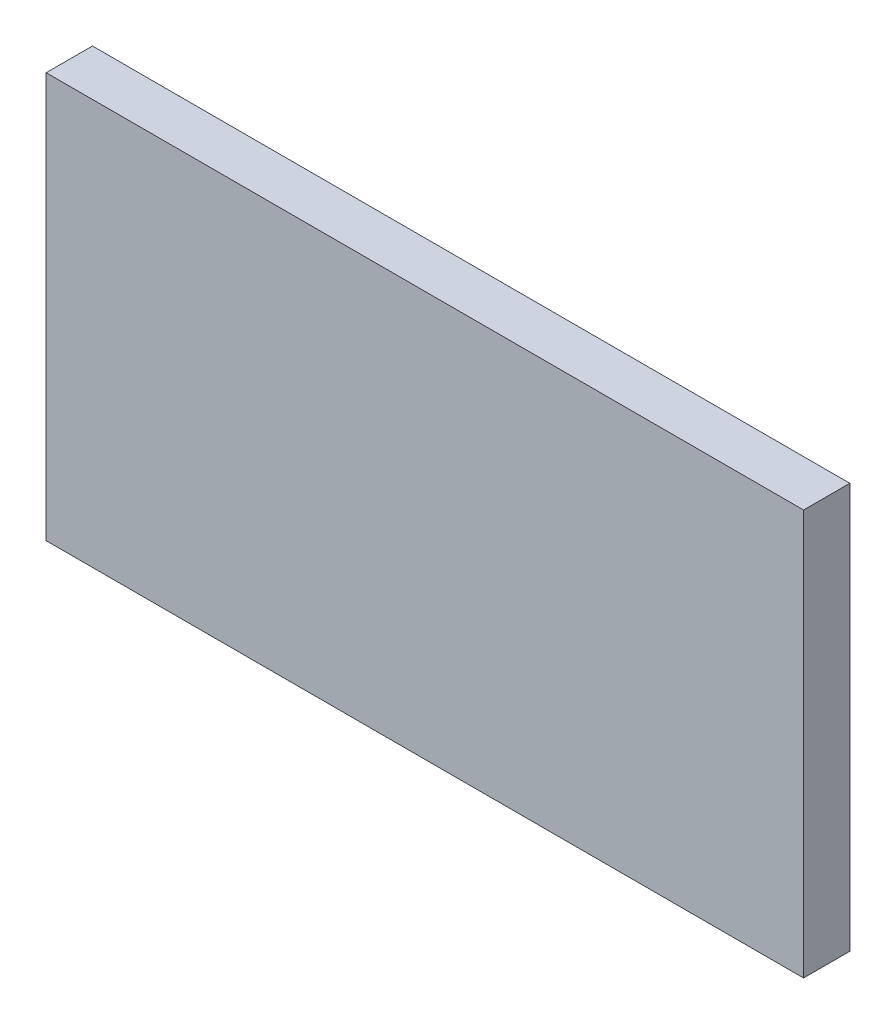
from build123d import *

# Parameters (mm, degrees)
SKETCH1_W           = 303.62705403
SKETCH1_H           = 162.480816863
SKETCH1_W_2         = 301.08705403
SKETCH1_H_2         = 159.940816863
BOSS_EXTRUDE1_DEPTH = 18.542


with BuildPart() as part:
    # Sketch1 → Boss-Extrude1 (new body)
    # profile 1 of 2: a face of its own
    with BuildSketch(Plane.XY):
        with Locations((0.895240385, -4.878361893)):
            Rectangle(SKETCH1_W, SKETCH1_H)
        with Locations((0.895240385, -4.878361893)):
            Rectangle(SKETCH1_W_2, SKETCH1_H_2, mode=Mode.SUBTRACT)
    # profile 2 of 2: a face of its own
    with BuildSketch(Plane.XY):
        with Locations((0.895240385, -4.878361893)):
            Rectangle(SKETCH1_W_2, SKETCH1_H_2)
    extrude(amount=-BOSS_EXTRUDE1_DEPTH)


solid = part.part
